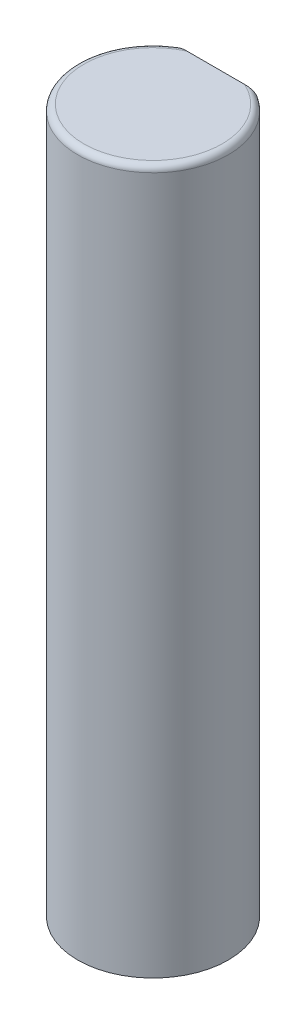
from build123d import *

# Parameters (mm, degrees)
SKETCH1_R           = 3
BOSS_EXTRUDE1_DEPTH = 28
SKETCH2_W           = 6
SKETCH2_H           = 1
CUT_EXTRUDE1_DEPTH  = 12
FILLET1_R           = 0.25


with BuildPart() as part:
    # Sketch1 → Boss-Extrude1 (new body)
    with BuildSketch(Plane(origin=(0, 0, 0), x_dir=(1, 0, 0), z_dir=(0, 1, 0))):
        with Locations(Location((0, 0, 0), (0, 0, 270))):
            Circle(SKETCH1_R)
    extrude(amount=BOSS_EXTRUDE1_DEPTH)

    # Sketch2 → Cut-Extrude1 (cut)
    with BuildSketch(Plane(origin=(0, 28, 0), x_dir=(1, 0, 0), z_dir=(0, 1, 0))):
        with Locations((0, 3)):
            Rectangle(SKETCH2_W, SKETCH2_H)
    extrude(amount=-CUT_EXTRUDE1_DEPTH, mode=Mode.SUBTRACT)

    # Fillet1
    fillet1_edges = [part.edges().sort_by_distance(p)[0] for p in [
        (-2.872281323, 28, 0.866025404),
    ]]
    fillet(fillet1_edges, radius=FILLET1_R)


solid = part.part
